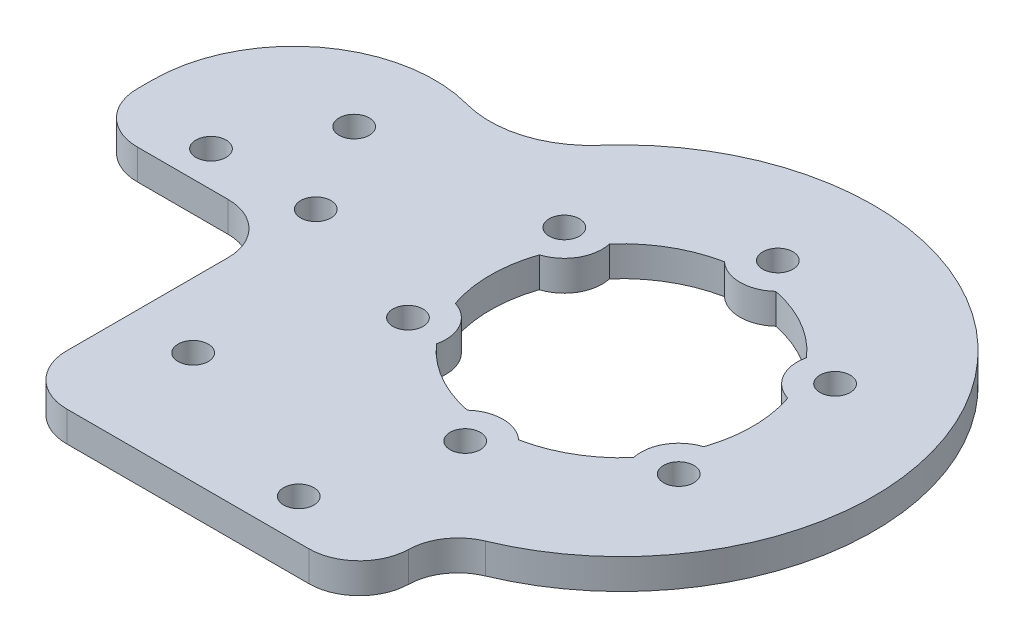
from build123d import *

# Parameters (mm, degrees)
SKETCH_1_R      = 1.5
EXTRUDE_1_DEPTH = 3
FILLET_1_R      = 5
FILLET_2_R      = 10
FILLET_6_R      = 5
FILLET_7_R      = 5


with BuildPart() as part:
    # 草图1 → 凸台-拉伸1 (new body)
    with BuildSketch(Plane(origin=(0, 0, 0), x_dir=(1, 0, 0), z_dir=(0, 1, 0))):
        with BuildLine():
            Line((-46.499999325, -0.004997817), (-46.499999325, -6.504997817))
            Line((-46.499999325, -6.504997817), (-27.499999325, -6.504997817))
            Line((-27.499999325, -6.504997817), (-27.499999325, -32.5))
            Line((-27.499999325, -32.5), (6.5, -32.5))
            Line((6.5, -32.5), (6.5, -24.140215409))
            ThreePointArc((6.5, -24.140215409), (18.98987541, 16.25990873), (-22.851559401, 10.139340853))
            ThreePointArc((-22.851559401, 10.139340853), (-38.019140611, 12.86120129), (-46.499999325, -0.004997817))
        make_face()
        with Locations(Location((-32.499999325, 5.995002183, 0), (0, 0, 270))):
            Circle(SKETCH_1_R, mode=Mode.SUBTRACT)
        with Locations(Location((-27.303846902, -3.004997817, 0), (0, 0, 270))):
            Circle(SKETCH_1_R, mode=Mode.SUBTRACT)
        with Locations(Location((-3.5, -28.5, 0), (0, 0, 270))):
            Circle(SKETCH_1_R, mode=Mode.SUBTRACT)
        with Locations(Location((-37.696151748, -3.004997817, 0), (0, 0, 270))):
            Circle(SKETCH_1_R, mode=Mode.SUBTRACT)
        with Locations(Location((-21.058777701, -21.409353158, 0), (0, 0, 270))):
            Circle(SKETCH_1_R, mode=Mode.SUBTRACT)
        with Locations(Location((0, 15.5, 0), (0, 0, 270))):
            Circle(SKETCH_1_R, mode=Mode.SUBTRACT)
        with Locations(Location((13.423393759, 7.75, 0), (0, 0, 270))):
            Circle(SKETCH_1_R, mode=Mode.SUBTRACT)
        with Locations(Location((13.423393759, -7.75, 0), (0, 0, 270))):
            Circle(SKETCH_1_R, mode=Mode.SUBTRACT)
        with Locations(Location((0, -15.5, 0), (0, 0, 270))):
            Circle(SKETCH_1_R, mode=Mode.SUBTRACT)
        with Locations(Location((-13.423393759, -7.75, 0), (0, 0, 270))):
            Circle(SKETCH_1_R, mode=Mode.SUBTRACT)
        with Locations(Location((-13.423393759, 7.75, 0), (0, 0, 270))):
            Circle(SKETCH_1_R, mode=Mode.SUBTRACT)
        with BuildLine():
            ThreePointArc((-12.313744557, 4.167936537), (-13, 0), (-12.313744557, -4.167936537))
            ThreePointArc((-12.313744557, -4.167936537), (-10.175798494, -5.875), (-9.766411201, -8.580047334))
            ThreePointArc((-9.766411201, -8.580047334), (-6.5, -11.258330249), (-2.547333356, -12.747983871))
            ThreePointArc((-2.547333356, -12.747983871), (0, -11.75), (2.547333356, -12.747983871))
            ThreePointArc((2.547333356, -12.747983871), (6.5, -11.258330249), (9.766411201, -8.580047334))
            ThreePointArc((9.766411201, -8.580047334), (10.175798494, -5.875), (12.313744557, -4.167936537))
            ThreePointArc((12.313744557, -4.167936537), (13, 0), (12.313744557, 4.167936537))
            ThreePointArc((12.313744557, 4.167936537), (10.175798494, 5.875), (9.766411201, 8.580047334))
            ThreePointArc((9.766411201, 8.580047334), (6.5, 11.258330249), (2.547333356, 12.747983871))
            ThreePointArc((2.547333356, 12.747983871), (0, 11.75), (-2.547333356, 12.747983871))
            ThreePointArc((-2.547333356, 12.747983871), (-6.5, 11.258330249), (-9.766411201, 8.580047334))
            ThreePointArc((-9.766411201, 8.580047334), (-10.175798494, 5.875), (-12.313744557, 4.167936537))
        make_face(mode=Mode.SUBTRACT)
    extrude(amount=EXTRUDE_1_DEPTH)

    # 圆角1
    fillet_1_edges = [part.edges().sort_by_distance(p)[0] for p in [
        (-27.499999325, 1.5, 32.5),
        (-27.499999325, 1.5, 6.504997817),
        (-46.499999325, 1.5, 6.504997817),
    ]]
    fillet(fillet_1_edges, radius=FILLET_1_R)

    # 圆角2
    fillet_2_edges = [part.edges().sort_by_distance(p)[0] for p in [
        (-22.851559401, 1.5, -10.139340853),
    ]]
    fillet(fillet_2_edges, radius=FILLET_2_R)

    # 圆角6
    fillet_6_edges = [part.edges().sort_by_distance(p)[0] for p in [
        (6.5, 1.5, 24.140215409),
    ]]
    fillet(fillet_6_edges, radius=FILLET_6_R)

    # 圆角7
    fillet_7_edges = [part.edges().sort_by_distance(p)[0] for p in [
        (6.5, 1.5, 32.5),
    ]]
    fillet(fillet_7_edges, radius=FILLET_7_R)


solid = part.part
